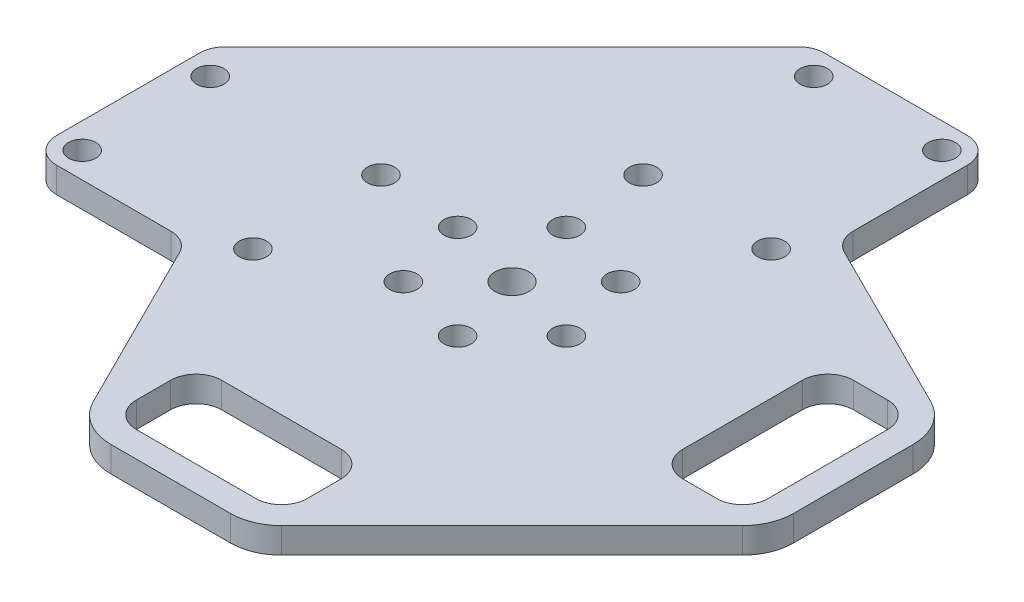
from build123d import *

# Parameters (mm, degrees)
BOSS_EXTRUDE1_DEPTH      = 3
M3_CLEARANCE_HOLE1_D     = 3.2
M3_CLEARANCE_HOLE2_D     = 3.2
F_4_0_4_DIAMETER_HOLE1_D = 4
EXTRUDE_THIN1_DEPTH      = 3
BOSS_EXTRUDE4_START      = -3
BOSS_EXTRUDE4_DEPTH      = 3
FILLET4_R                = 3


with BuildPart() as part:
    # Sketch2 → Boss-Extrude1 (new body)
    with BuildSketch(Plane(origin=(0, 0, 0), x_dir=(1, 0, 0), z_dir=(0, 1, 0))):
        with BuildLine():
            Line((-6.15, 41.5), (14.85, 41.5))
            Line((14.85, 41.5), (14.85, 15.5))
            Line((14.85, 15.5), (13.66471398, -0.982645329))
            ThreePointArc((13.66471398, -0.982645329), (9.687362902, -9.687362902), (0.982645329, -13.66471398))
            Line((0.982645329, -13.66471398), (-15.5, -14.85))
            Line((-15.5, -14.85), (-41.5, -14.85))
            Line((-41.5, -14.85), (-41.5, 6.15))
            Line((-41.5, 6.15), (-6.15, 41.5))
        make_face()
    extrude(amount=BOSS_EXTRUDE1_DEPTH)

    # M3 Clearance Hole1 (through all)
    with Locations(Plane(origin=(0, 3, 0), x_dir=(1, 0, 0), z_dir=(0, 1, 0))):
        with Locations((-38.5, 3.15), (-18.5, 3.15), (-18.5, -11.85), (-38.5, -11.85), (-3.15, 18.5), (-3.15, 38.5), (11.85, 38.5), (11.85, 18.5)):
            Hole(M3_CLEARANCE_HOLE1_D / 2)

    # M3 Clearance Hole2 (through all)
    with Locations(Plane(origin=(0, 3, 0), x_dir=(1, 0, 0), z_dir=(0, 1, 0))):
        with Locations((-2.329371406, 8.693332437), (6.363961031, 6.363961031), (8.693332437, -2.329371406), (2.329371406, -8.693332437), (-6.363961031, -6.363961031), (-8.693332437, 2.329371406)):
            Hole(M3_CLEARANCE_HOLE2_D / 2)

    # Ø4.0 (4) Diameter Hole1 (through all)
    with Locations(Plane(origin=(0, 3, 0), x_dir=(1, 0, 0), z_dir=(0, 1, 0))):
        with Locations((0, 0)):
            Hole(F_4_0_4_DIAMETER_HOLE1_D / 2)



with BuildPart() as body_2:
    # Sketch11 → Extrude-Thin1 (new body)
    with BuildSketch(Plane(origin=(0, 3, 0), x_dir=(1, 0, 0), z_dir=(0, 1, 0))):
        with BuildLine():
            Line((-7, -24), (7, -24))
            ThreePointArc((7, -24), (11.242640687, -25.757359313), (13, -30))
            Line((13, -30), (13, -34))
            ThreePointArc((13, -34), (11.242640687, -38.242640687), (7, -40))
            Line((7, -40), (-7, -40))
            ThreePointArc((-7, -40), (-11.242640687, -38.242640687), (-13, -34))
            Line((-13, -34), (-13, -30))
            ThreePointArc((-13, -30), (-11.242640687, -25.757359313), (-7, -24))
        make_face()
        with BuildLine():
            Line((-7, -27), (7, -27))
            ThreePointArc((7, -27), (9.121320344, -27.878679656), (10, -30))
            Line((10, -30), (10, -34))
            ThreePointArc((10, -34), (9.121320344, -36.121320344), (7, -37))
            Line((7, -37), (-7, -37))
            ThreePointArc((-7, -37), (-9.121320344, -36.121320344), (-10, -34))
            Line((-10, -34), (-10, -30))
            ThreePointArc((-10, -30), (-9.121320344, -27.878679656), (-7, -27))
        make_face(mode=Mode.SUBTRACT)
    extrude(amount=-EXTRUDE_THIN1_DEPTH)


with BuildPart() as part_1:
    add(part.part)

    add(body_2.part)  # Boss-Extrude4 merges body 2
    # Sketch12 → Boss-Extrude4 (add)
    with BuildSketch(Plane(origin=(0, 3, 0), x_dir=(1, 0, 0), z_dir=(0, 1, 0)).offset(BOSS_EXTRUDE4_START)):
        with BuildLine():
            Line((11.242640687, -38.242640687), (24.742640687, -24.742640687))
            Line((24.742640687, -24.742640687), (9.687362902, -9.687362902))
            ThreePointArc((9.687362902, -9.687362902), (5.693601612, -12.460854733), (0.982645329, -13.66471398))
            Line((0.982645329, -13.66471398), (-15.5, -14.85))
            Line((-15.5, -14.85), (-23.260783473, -14.85))
            Line((-23.260783473, -14.85), (-12.368766817, -36.678869699))
            ThreePointArc((-12.368766817, -36.678869699), (-12.84005997, -35.376117563), (-13, -34))
            Line((-13, -34), (-13, -30))
            ThreePointArc((-13, -30), (-11.242640687, -25.757359313), (-7, -24))
            Line((-7, -24), (7, -24))
            ThreePointArc((7, -24), (11.242640687, -25.757359313), (13, -30))
            Line((13, -30), (13, -34))
            ThreePointArc((13, -34), (12.543277195, -36.296100594), (11.242640687, -38.242640687))
        make_face()
    extrude(amount=BOSS_EXTRUDE4_DEPTH)

    # Mirror4: part across plane


with BuildPart() as part_2:
    add(part_1.part)
    add(part_1.part.mirror(Plane(origin=(0, 0, 0), x_dir=(0.7071067811865478, 0, 0.7071067811865472), z_dir=(-0.7071067811865475, 0, 0.7071067811865477))))

    # Fillet4
    fillet4_edges = [part_2.edges().sort_by_distance(p)[0] for p in [
        (-23.260783473, 1.5, 14.85),
        (-6.15, 1.5, -41.5),
        (14.85, 1.5, -41.5),
        (-41.5, 1.5, 14.85),
        (-41.5, 1.5, -6.15),
        (14.85, 1.5, -23.260783473),
    ]]
    fillet(fillet4_edges, radius=FILLET4_R)


solid = part_2.part
